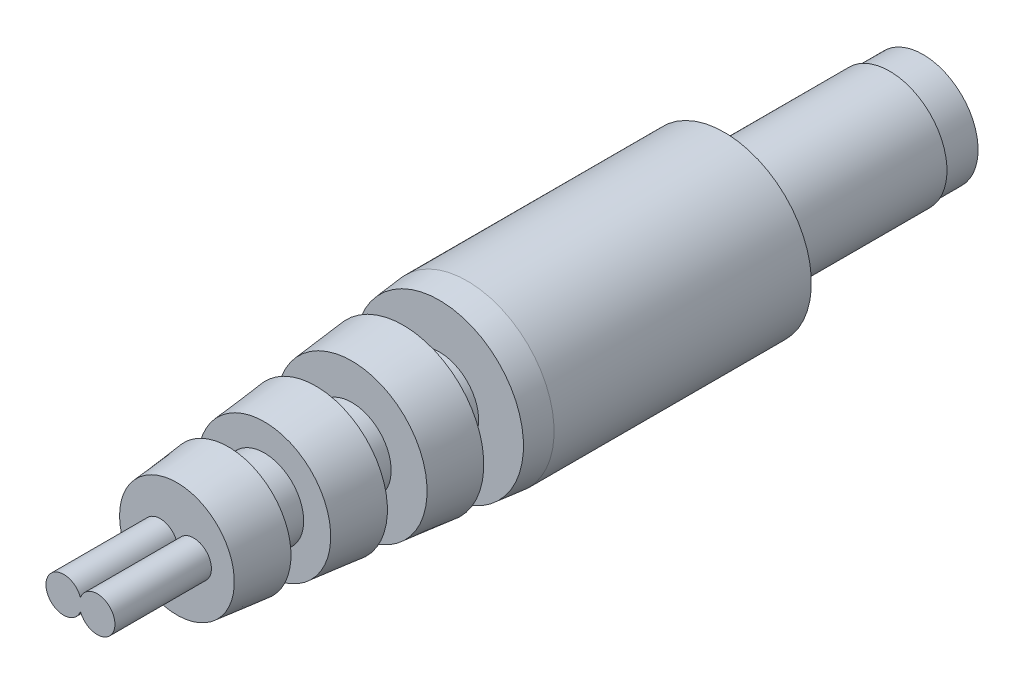
from build123d import *

# Parameters (mm, degrees)
SKETCH2_R      = 1.1049
EXTRUDE1_DEPTH = 10.16
EXTRUDE2_DEPTH = 4.7625


with BuildPart() as part:
    # Sketch1 → Revolve6 (revolve)
    with BuildSketch(Plane(origin=(0, 0, 0), x_dir=(0, 0, -1), z_dir=(1, 0, 0)), mode=Mode.PRIVATE) as revolve6_sk:
        Polygon((0, 0), (0, 2.7178), (-1.651, 2.7178), (-1.651, 2.8321), (-9.8044, 2.8321), (-9.8044, 4.2926), (-22.5044, 4.2926), (-23.876, 4.152764894), (-23.876, 1.938884955), (-25.654, 1.938884955), (-25.654, 3.971497163), (-28.194, 3.712543262), (-28.194, 1.938884955), (-29.972, 1.938884955), (-29.972, 3.531275532), (-32.512, 3.272321631), (-32.512, 1.938884955), (-34.29, 1.938884955), (-34.29, 3.091053901), (-36.83, 2.8321), (-36.83, 0), align=None)
    revolve(revolve6_sk.sketch.rotate(Axis((0, 0, 0), (0, 0, 1)), 90), axis=Axis((0, 0, 0), (0, 0, 1)))

    # Sketch2 → Extrude1 (cut)
    with BuildSketch(Plane(origin=(0, 0, 0), x_dir=(-1, 0, 0), z_dir=(0, 0, -1))):
        Circle(SKETCH2_R)
    extrude(amount=-EXTRUDE1_DEPTH, mode=Mode.SUBTRACT)

    # Sketch4 → Extrude2 (add)
    with BuildSketch(Plane.XY.offset(36.83)):
        with BuildLine():
            ThreePointArc((0, -0.291949011), (1.70253693, 0), (0, 0.291949011))
            ThreePointArc((0, 0.291949011), (-1.70253693, 0), (0, -0.291949011))
        make_face()
    extrude(amount=EXTRUDE2_DEPTH)


solid = part.part
